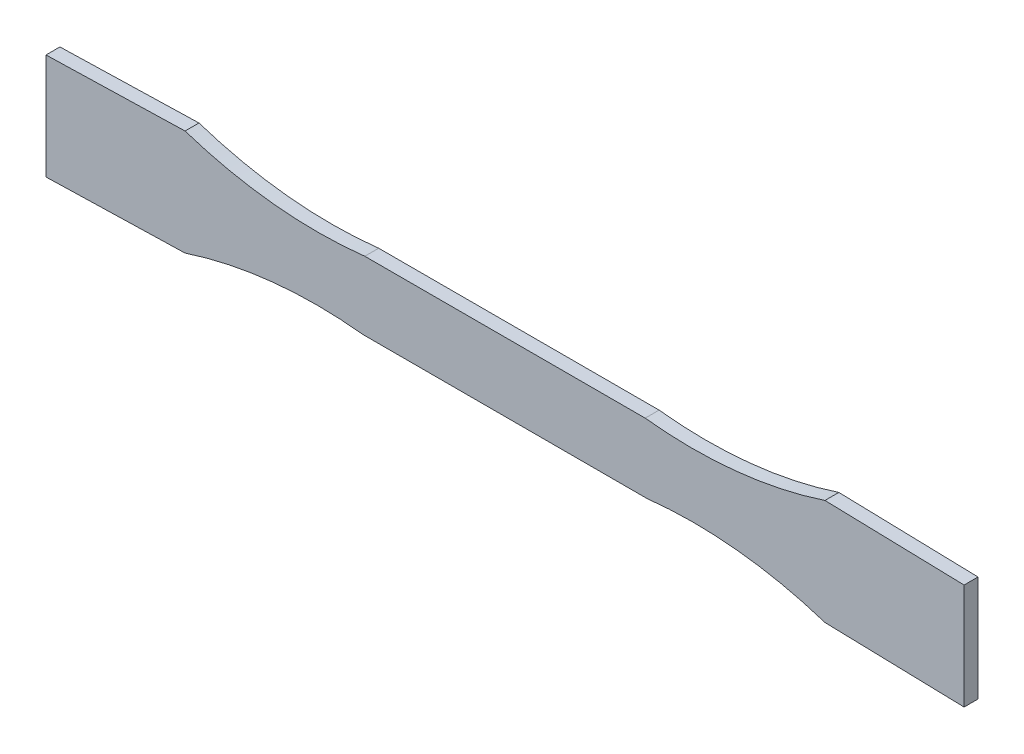
from build123d import *

# Parameters (mm, degrees)
BOSS_EXTRUDE2_DEPTH = 2.5


with BuildPart() as part:
    # Sketch2 → Boss-Extrude2 (new body)
    with BuildSketch(Plane.XY):
        with BuildLine():
            Line((-46.617380763, -10.460553871), (-21.626035611, -9.802779228))
            ThreePointArc((-21.626035611, -9.802779228), (-5.813327465, -6.438323514), (10.353247207, -6.494577557))
            Line((10.353247207, -6.494577557), (61.390562189, -6.494577557))
            ThreePointArc((61.390562189, -6.494577557), (77.567971425, -6.436016399), (93.391274085, -9.802779228))
            Line((93.391274085, -9.802779228), (118.382619237, -10.460553871))
            Line((118.382619237, -10.460553871), (118.382619237, 8.539446129))
            Line((118.382619237, 8.539446129), (93.373964389, 9.197220772))
            ThreePointArc((93.373964389, 9.197220772), (77.401482855, 5.780517491), (61.067824801, 5.855632475))
            Line((61.067824801, 5.855632475), (10.675984594, 5.855632475))
            ThreePointArc((10.675984594, 5.855632475), (-5.655590446, 5.780965556), (-21.626035611, 9.197220772))
            Line((-21.626035611, 9.197220772), (-46.617380763, 8.539446129))
            Line((-46.617380763, 8.539446129), (-46.617380763, -10.460553871))
        make_face()
    extrude(amount=BOSS_EXTRUDE2_DEPTH)


solid = part.part
